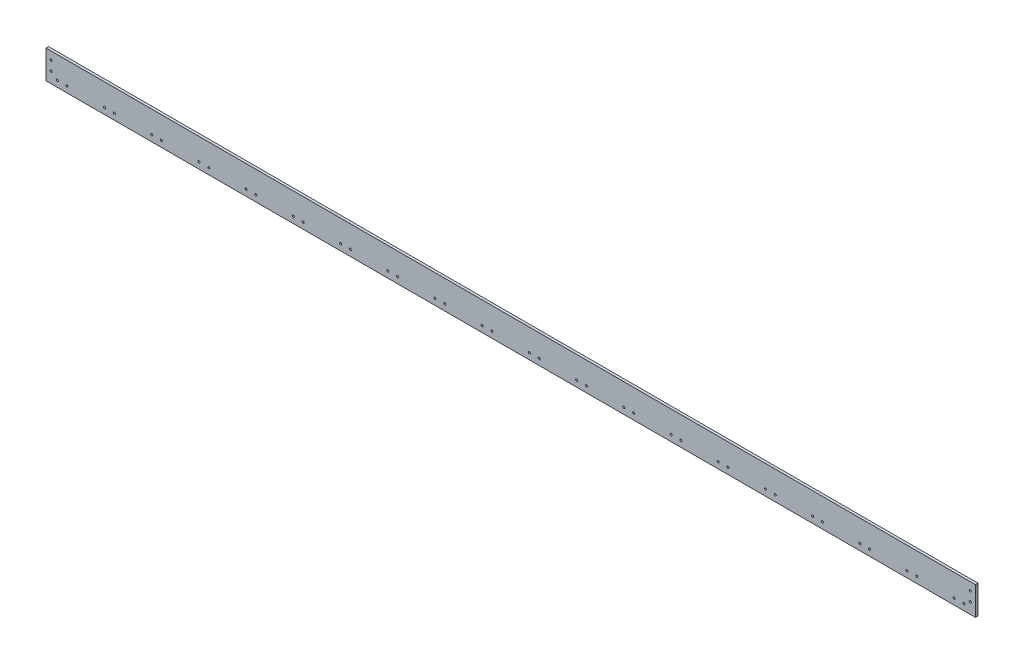
from build123d import *

# Parameters (mm, degrees)
SKETCH1_W           = 2286
SKETCH1_H           = 69.85
BOSS_EXTRUDE1_DEPTH = 6.35
SKETCH2_R           = 2.54
CUT_EXTRUDE1_DEPTH  = 6.35
SKETCH3_R           = 2.54
CUT_EXTRUDE2_DEPTH  = 6.35
LPATTERN2_COUNT     = 20
LPATTERN2_PITCH     = 116.104736842


with BuildPart() as part:
    # Sketch1 → Boss-Extrude1 (new body)
    with BuildSketch(Plane.XY):
        with Locations((1143, 34.925)):
            Rectangle(SKETCH1_W, SKETCH1_H)
    extrude(amount=BOSS_EXTRUDE1_DEPTH)

    # Sketch2 → Cut-Extrude1 (cut)
    with BuildSketch(Plane.XY.offset(6.35)):
        with Locations((27.94, 15.24)):
            Circle(SKETCH2_R)
        with Locations((52.07, 15.24)):
            Circle(SKETCH2_R)
    cut_extrude1 = extrude(amount=-CUT_EXTRUDE1_DEPTH, mode=Mode.SUBTRACT)

    # Sketch3 → Cut-Extrude2 (cut)
    with BuildSketch(Plane.XY.offset(6.35)):
        with Locations((12.7, 26.67)):
            Circle(SKETCH3_R)
        with Locations((12.7, 50.8)):
            Circle(SKETCH3_R)
        with Locations(Location((2273.3, 26.67, 0), (0, 0, 180))):
            Circle(SKETCH3_R)
        with Locations(Location((2273.3, 50.8, 0), (0, 0, 180))):
            Circle(SKETCH3_R)
    extrude(amount=-CUT_EXTRUDE2_DEPTH, mode=Mode.SUBTRACT)

    # LPattern2: Cut-Extrude1 ×20
    with Locations(*[(i * LPATTERN2_PITCH, 0, 0) for i in range(1, LPATTERN2_COUNT)]):
        add(cut_extrude1, mode=Mode.SUBTRACT)


solid = part.part
